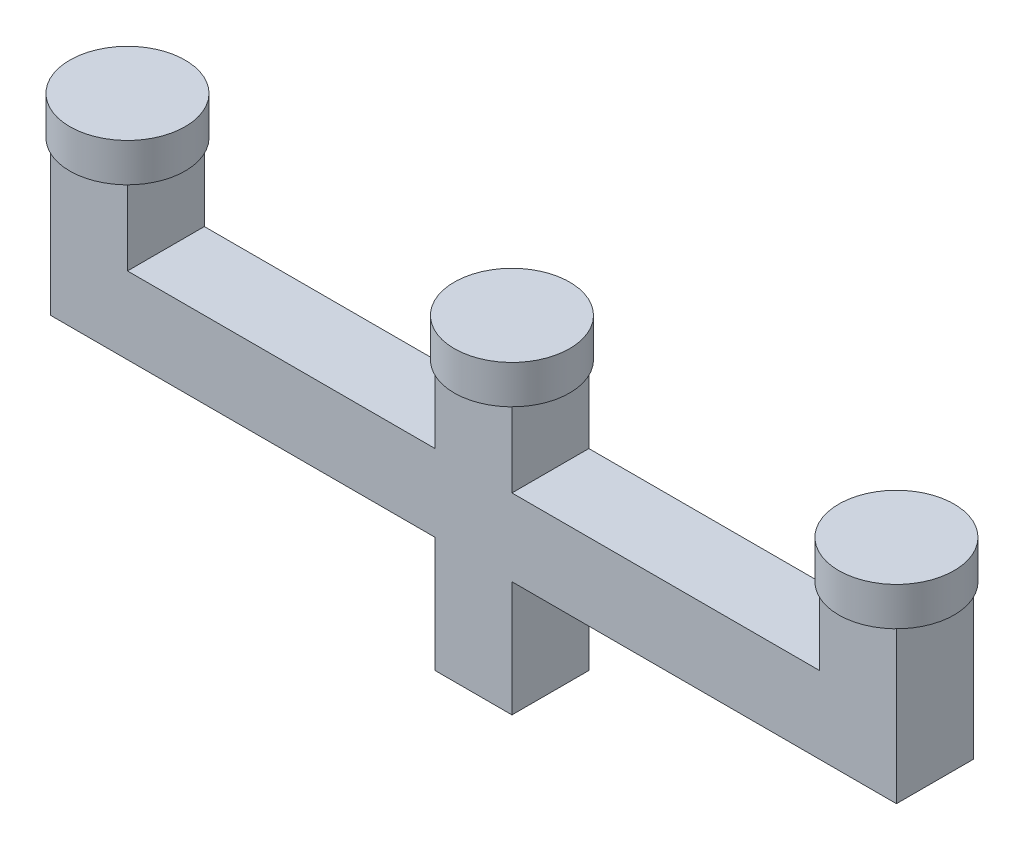
from build123d import *

# Parameters (mm, degrees)
BOSS_EXTRU_1_DEPTH = 20
ESQUISSE2_W        = 20
ESQUISSE2_H        = 30
BOSS_EXTRU_2_DEPTH = 20
ESQUISSE3_R        = 15
BOSS_EXTRU_3_DEPTH = 10


with BuildPart() as part:
    # Esquisse1 → Boss.-Extru.1 (new body)
    with BuildSketch(Plane.XY):
        Polygon((110, 0), (-110, 0), (-110, 40), (-90, 40), (-90, 20), (-10, 20), (-10, 40), (10, 40), (10, 20), (90, 20), (90, 40), (110, 40), align=None)
    extrude(amount=BOSS_EXTRU_1_DEPTH)

    # Esquisse2 → Boss.-Extru.2 (add)
    with BuildSketch(Plane.XY.offset(20)):
        with Locations((0, -15)):
            Rectangle(ESQUISSE2_W, ESQUISSE2_H)
    extrude(amount=-BOSS_EXTRU_2_DEPTH)

    # Esquisse3 → Boss.-Extru.3 (add)
    with BuildSketch(Plane(origin=(0, 40, 0), x_dir=(1, 0, 0), z_dir=(0, 1, 0))):
        with Locations(Location((0, -10, 0), (0, 0, 270))):
            Circle(ESQUISSE3_R)
        with Locations(Location((-100, -10, 0), (0, 0, 270))):
            Circle(ESQUISSE3_R)
        with Locations(Location((100, -10, 0), (0, 0, 270))):
            Circle(ESQUISSE3_R)
    extrude(amount=BOSS_EXTRU_3_DEPTH)


solid = part.part
